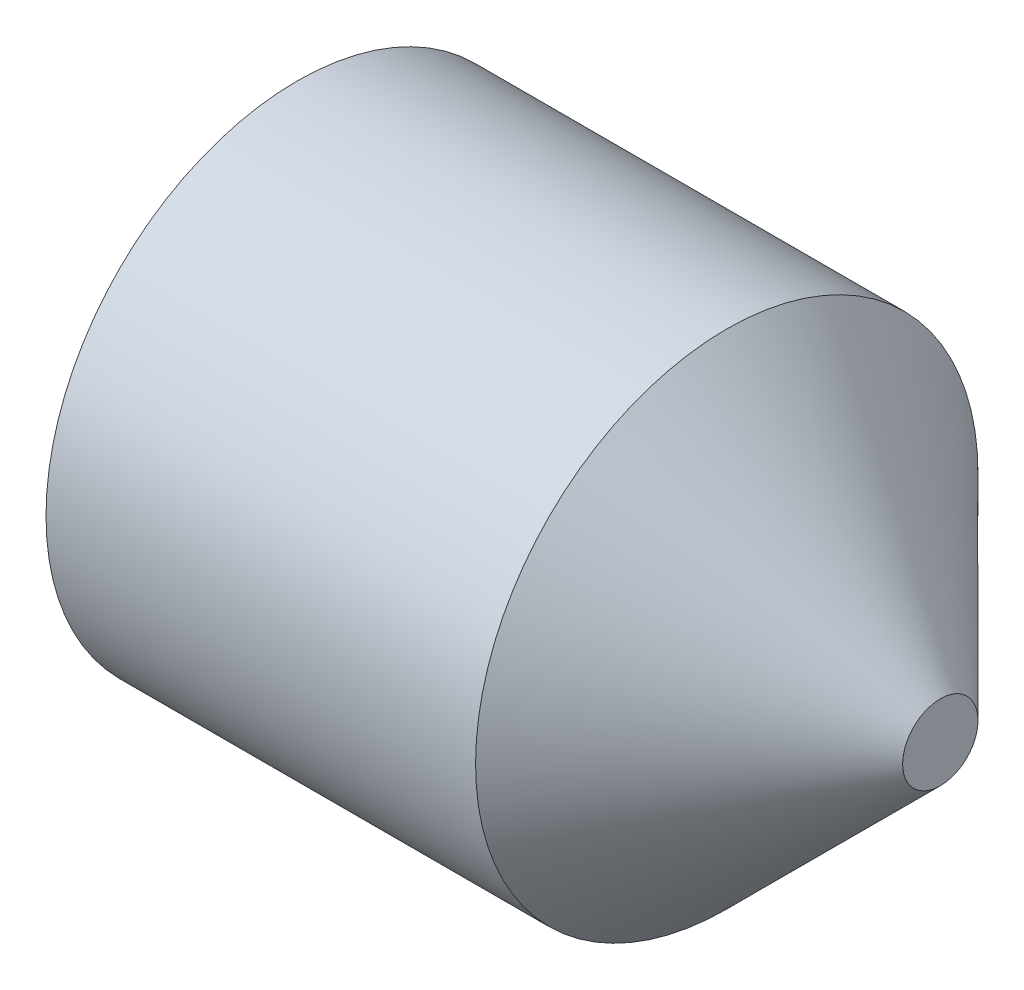
from build123d import *

# Parameters (mm, degrees)
HEX_2_DEPTH = 3.5


with BuildPart() as part:
    # BodySke → BaseBody (revolve)
    with BuildSketch(Plane.XY, mode=Mode.PRIVATE) as basebody_sk:
        Polygon((0, 0), (0, 2.4455), (0.320140724, 3), (5.45, 3), (8, 0.45), (8, 0), align=None)
    revolve(basebody_sk.sketch.rotate(Axis((-12.7, 0, 0), (1, 0, 0)), 90), axis=Axis((-12.7, 0, 0), (1, 0, 0)))

    # Sketch2 → Hex 2 (cut)
    with BuildSketch(Plane.ZY):
        Polygon((0.866025404, 1.5), (-0.866025404, 1.5), (-1.732050808, 0), (-0.866025404, -1.5), (0.866025404, -1.5), (1.732050808, 0), align=None)
    extrude(amount=-HEX_2_DEPTH, mode=Mode.SUBTRACT)


solid = part.part
